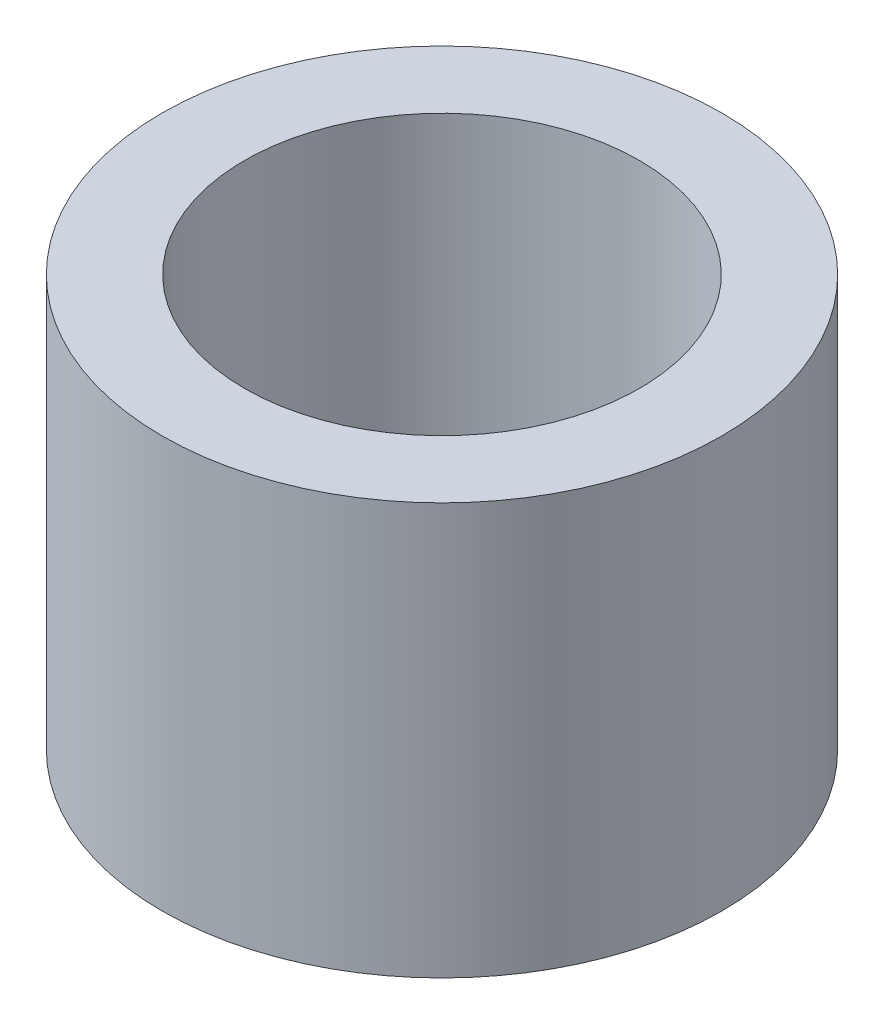
from build123d import *

# Parameters (mm, degrees)
SKETCH1_R           = 17
SKETCH1_R_2         = 12
BOSS_EXTRUDE1_DEPTH = 12.5


with BuildPart() as part:
    # Sketch1 → Boss-Extrude1 (new, symmetric)
    with BuildSketch(Plane(origin=(0, 0, 0), x_dir=(1, 0, 0), z_dir=(0, 1, 0))):
        with Locations(Location((0, 0, 0), (0, 0, 270))):
            Circle(SKETCH1_R)
        with Locations(Location((0, 0, 0), (0, 0, 270))):
            Circle(SKETCH1_R_2, mode=Mode.SUBTRACT)
    extrude(amount=BOSS_EXTRUDE1_DEPTH, both=True)


solid = part.part
